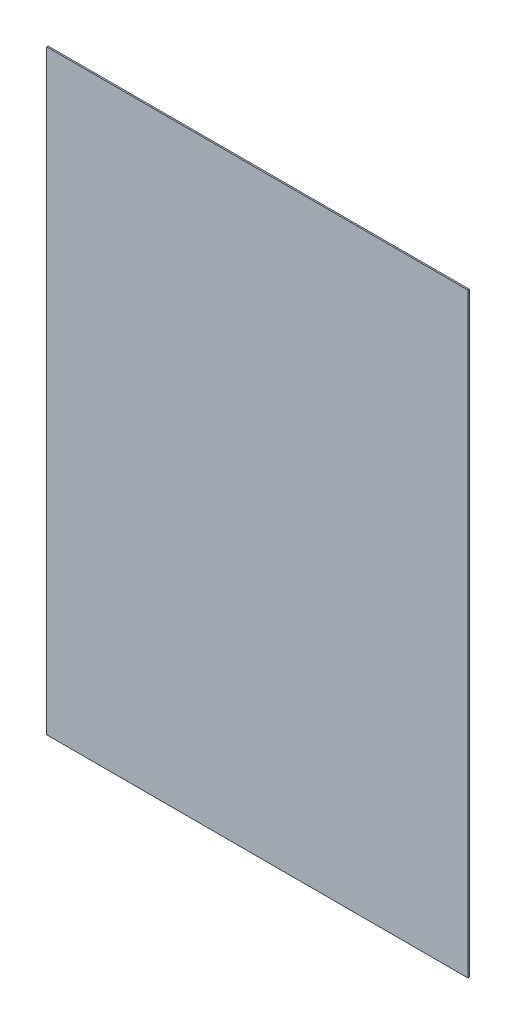
from build123d import *

# Parameters (mm, degrees)
CROQUIS1_W              = 148.5
CROQUIS1_H              = 210
SALIENTE_EXTRUIR1_DEPTH = 0.5


with BuildPart() as part:
    # Croquis1 → Saliente-Extruir1 (new body)
    with BuildSketch(Plane.XY):
        with Locations((74.25, 105)):
            Rectangle(CROQUIS1_W, CROQUIS1_H)
    extrude(amount=SALIENTE_EXTRUIR1_DEPTH)


solid = part.part
